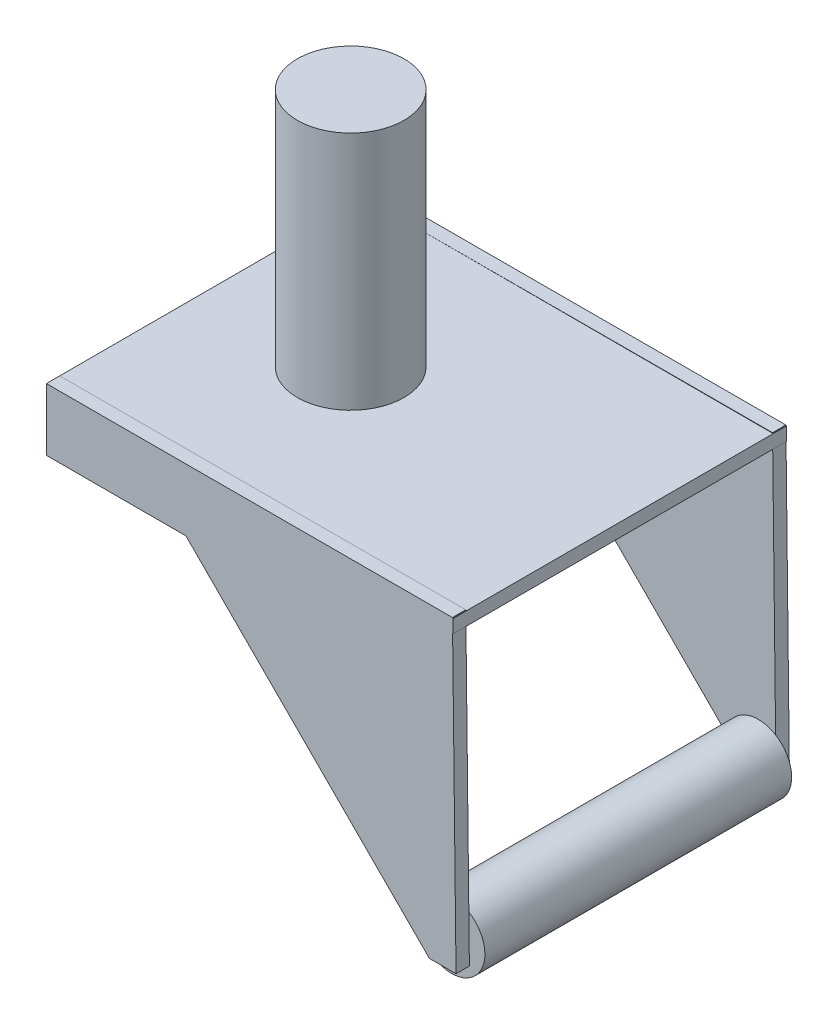
from build123d import *

# Parameters (mm, degrees)
ESQUISSE1_W        = 30.5
ESQUISSE1_H        = 25
BOSS_EXTRU_1_DEPTH = 1
BOSS_EXTRU_2_DEPTH = 1
ESQUISSE3_R        = 2.5
BOSS_EXTRU_3_DEPTH = 23
ESQUISSE4_R        = 4
BOSS_EXTRU_4_DEPTH = 18


with BuildPart() as part:
    # Esquisse1 → Boss.-Extru.1 (new body)
    with BuildSketch(Plane(origin=(0, 0, 0), x_dir=(1, 0, 0), z_dir=(0, 1, 0))):
        Rectangle(ESQUISSE1_W, ESQUISSE1_H)
    extrude(amount=BOSS_EXTRU_1_DEPTH)

    # Esquisse2 → Boss.-Extru.2 (add)
    with BuildSketch(Plane.XY.offset(12.5)):
        Polygon((15.199854564, 1.034402705), (15.467639278, -21.965597295), (13.467639278, -21.965597295), (-4.785365363, -3.659095072), (-15.23307626, -3.659095072), (-15.25, 1), align=None)
    boss_extru_2 = extrude(amount=-BOSS_EXTRU_2_DEPTH)

    # Symétrie1: Boss.-Extru.2 across plane
    add(boss_extru_2.mirror(Plane.XY))

    # Esquisse3 → Boss.-Extru.3 (add)
    with BuildSketch(Plane.XY.offset(-11.5)):
        with Locations(Location((14.132711903, -20.613073056, 0), (0, 0, 169.692708603))):
            Circle(ESQUISSE3_R)
    extrude(amount=BOSS_EXTRU_3_DEPTH)

    # Esquisse4 → Boss.-Extru.4 (add)
    with BuildSketch(Plane(origin=(0, 1, 0), x_dir=(1, 0, 0), z_dir=(0, 1, 0))):
        with Locations(Location((-4.931252749, 0, 0), (0, 0, 270))):
            Circle(ESQUISSE4_R)
    extrude(amount=BOSS_EXTRU_4_DEPTH)


solid = part.part
